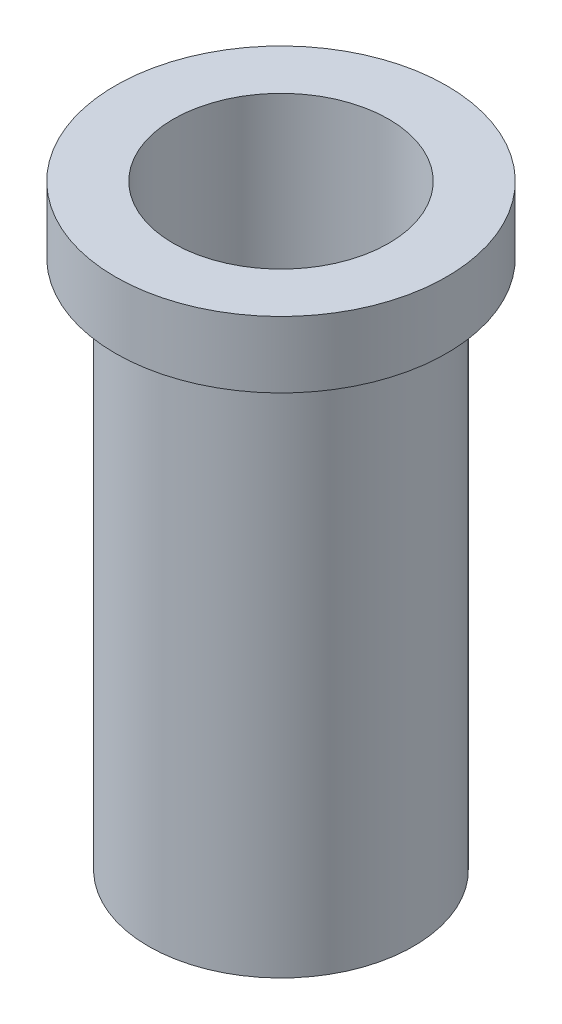
from build123d import *

# Parameters (mm, degrees)
SKIZZE1_R                       = 5
AUFSATZ_LINEAR_AUSTRAGEN1_DEPTH = 2
SKIZZE2_R                       = 4
AUFSATZ_LINEAR_AUSTRAGEN2_DEPTH = 16
SKIZZE3_R                       = 3.25
SCHNITT_LINEAR_AUSTRAGEN1_DEPTH = 16
SKIZZE4_R                       = 1.5
SCHNITT_LINEAR_AUSTRAGEN2_DEPTH = 2


with BuildPart() as part:
    # Skizze1 → Aufsatz-Linear austragen1 (new body)
    with BuildSketch(Plane(origin=(0, 0, 0), x_dir=(1, 0, 0), z_dir=(0, 1, 0))):
        with Locations(Location((0, 0, 0), (0, 0, 270))):
            Circle(SKIZZE1_R)
    extrude(amount=AUFSATZ_LINEAR_AUSTRAGEN1_DEPTH)

    # Skizze2 → Aufsatz-Linear austragen2 (add)
    with BuildSketch(Plane.XZ):
        with Locations(Location((0, 0, 0), (0, 0, 270))):
            Circle(SKIZZE2_R)
    extrude(amount=AUFSATZ_LINEAR_AUSTRAGEN2_DEPTH)

    # Skizze3 → Schnitt-Linear austragen1 (cut)
    with BuildSketch(Plane(origin=(0, 2, 0), x_dir=(1, 0, 0), z_dir=(0, 1, 0))):
        with Locations(Location((0, 0, 0), (0, 0, 270))):
            Circle(SKIZZE3_R)
    extrude(amount=-SCHNITT_LINEAR_AUSTRAGEN1_DEPTH, mode=Mode.SUBTRACT)

    # Skizze4 → Schnitt-Linear austragen2 (cut)
    with BuildSketch(Plane.XZ.offset(16)):
        with Locations(Location((0, 0, 0), (0, 0, 270))):
            Circle(SKIZZE4_R)
    extrude(amount=-SCHNITT_LINEAR_AUSTRAGEN2_DEPTH, mode=Mode.SUBTRACT)


solid = part.part
